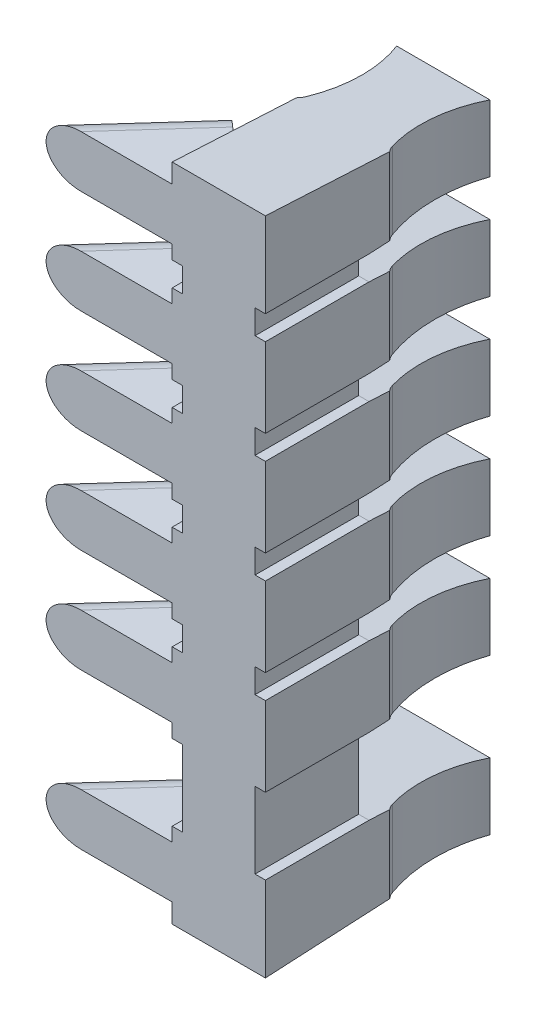
from build123d import *

# Parameters (mm, degrees)
SKETCH1_W           = 15
SKETCH1_H           = 30
BOSS_EXTRUDE1_DEPTH = 7
CUT_EXTRUDE1_START  = -0.3
CUT_EXTRUDE1_DEPTH  = 2.1
CUT_EXTRUDE4_DEPTH  = 2.7
BOSS_EXTRUDE2_DEPTH = 24.556743
CUT_EXTRUDE2_DEPTH  = 27.627139608
CUT_EXTRUDE3_DEPTH  = 27.401285317
SKETCH13_W          = 10
SKETCH13_H          = 20
BOSS_EXTRUDE3_DEPTH = 7
SKETCH14_W          = 3.65
SKETCH14_H          = 19.113486034
CUT_EXTRUDE5_DEPTH  = 13.592908206


with BuildPart() as part:
    # Sketch1 → Boss-Extrude1 (new body)
    with BuildSketch(Plane.XY):
        Rectangle(SKETCH1_W, SKETCH1_H)
    extrude(amount=-BOSS_EXTRUDE1_DEPTH)

    # Sketch8 → Cut-Extrude1 (cut)
    with BuildSketch(Plane(origin=(1.35, 0, 0), x_dir=(0, 0, -1), z_dir=(1, 0, 0)).offset(CUT_EXTRUDE1_START)):
        Polygon((6.5, -4.716092451), (6.5, -2.783907549), (3, -2.600480321), (3, -1.899519679), (6.5, -1.716092451), (6.5, 0.216092451), (3, 0.399519679), (3, 1.100480321), (6.5, 1.283907549), (6.5, 3.216092451), (3, 3.399519679), (3, 4.100480321), (6.5, 4.283907549), (6.5, 6.216092451), (3, 6.399519679), (3, 7.100480321), (6.5, 7.283907549), (6.5, 9.216092451), (0, 9.556743017), (0, -9.556743017), (6.5, -9.216092451), (6.5, -7.283907549), (3, -7.100480321), (3, -4.899519679), align=None)
    extrude(amount=-CUT_EXTRUDE1_DEPTH, mode=Mode.SUBTRACT)

    # Sketch7 → Cut-Extrude4 (cut)
    with BuildSketch(Plane(origin=(1.35, 0, 0), x_dir=(0, 0, -1), z_dir=(1, 0, 0))):
        Polygon((3, 4.100480321), (0, 4.100480321), (0, 6.399519679), (3, 6.399519679), (6.5, 6.216092451), (6.5, 4.283907549), align=None)
        Polygon((3, 1.100480321), (0, 1.100480321), (0, 3.399519679), (3, 3.399519679), (6.5, 3.216092451), (6.5, 1.283907549), align=None)
        Polygon((3, -1.899519679), (0, -1.899519679), (0, 0.399519679), (3, 0.399519679), (6.5, 0.216092451), (6.5, -1.716092451), align=None)
        Polygon((3, -4.899519679), (0, -4.899519679), (0, -2.600480321), (3, -2.600480321), (6.5, -2.783907549), (6.5, -4.716092451), align=None)
        Polygon((3, -7.100480321), (0, -7.100480321), (0, -9.556743017), (6.5, -9.216092451), (6.5, -7.283907549), align=None)
        Polygon((3, 7.100480321), (0, 7.100480321), (0, 9.556743017), (6.5, 9.216092451), (6.5, 7.283907549), align=None)
    extrude(amount=-CUT_EXTRUDE4_DEPTH, mode=Mode.SUBTRACT)

    # Sketch10 → Boss-Extrude2 (add)
    with BuildSketch(Plane(origin=(0, -9.556743017, 0), x_dir=(1, 0, 0), z_dir=(0, 1, 0))):
        with BuildLine():
            Line((1.35, 3.599507213), (1.35, 6.5))
            ThreePointArc((1.35, 6.5), (1.052815056, 5.148153684), (1.246508191, 3.777646361))
            ThreePointArc((1.246508191, 3.777646361), (1.288979573, 3.683188656), (1.35, 3.599507213))
        make_face()
        with BuildLine():
            Line((-1.35, 3.599507213), (-1.35, 6.5))
            ThreePointArc((-1.35, 6.5), (-1.052815056, 5.148153684), (-1.246508191, 3.777646361))
            ThreePointArc((-1.246508191, 3.777646361), (-1.288979573, 3.683188656), (-1.35, 3.599507213))
        make_face()
    extrude(amount=BOSS_EXTRUDE2_DEPTH)

    # Sketch12 → Cut-Extrude2 (cut, through all)
    with BuildSketch(Plane(origin=(3.10411931, 9.156194078, -3.38952842), x_dir=(0, -1, 0), z_dir=(0.669702306213578, 0, 0.7426296661541438))):
        with BuildLine():
            Line((0.156194078, -1.612037756), (0.156194078, -5.06124645))
            Line((0.156194078, -5.06124645), (1.656194078, -5.06124645))
            Line((1.656194078, -5.06124645), (1.656194078, -1.612037756))
            ThreePointArc((1.656194078, -1.612037756), (0.906194078, -0.862037756), (0.156194078, -1.612037756))
        make_face()
        with BuildLine():
            Line((3.156194078, -1.612037756), (3.156194078, -5.06124645))
            Line((3.156194078, -5.06124645), (4.656194078, -5.06124645))
            Line((4.656194078, -5.06124645), (4.656194078, -1.612037756))
            ThreePointArc((4.656194078, -1.612037756), (3.906194078, -0.862037756), (3.156194078, -1.612037756))
        make_face()
        with BuildLine():
            Line((6.156194078, -1.612037756), (6.156194078, -5.06124645))
            Line((6.156194078, -5.06124645), (7.656194078, -5.06124645))
            Line((7.656194078, -5.06124645), (7.656194078, -1.612037756))
            ThreePointArc((7.656194078, -1.612037756), (6.906194078, -0.862037756), (6.156194078, -1.612037756))
        make_face()
        with BuildLine():
            Line((9.156194078, -1.612037756), (9.156194078, -5.06124645))
            Line((9.156194078, -5.06124645), (10.656194078, -5.06124645))
            Line((10.656194078, -5.06124645), (10.656194078, -1.612037756))
            ThreePointArc((10.656194078, -1.612037756), (9.906194078, -0.862037756), (9.156194078, -1.612037756))
        make_face()
        with BuildLine():
            Line((12.156194078, -1.612037756), (12.156194078, -5.06124645))
            Line((12.156194078, -5.06124645), (13.656194078, -5.06124645))
            Line((13.656194078, -5.06124645), (13.656194078, -1.612037756))
            ThreePointArc((13.656194078, -1.612037756), (12.906194078, -0.862037756), (12.156194078, -1.612037756))
        make_face()
        with BuildLine():
            Line((16.656194078, -1.612037756), (16.656194078, -5.06124645))
            Line((16.656194078, -5.06124645), (18.156194078, -5.06124645))
            Line((18.156194078, -5.06124645), (18.156194078, -1.612037756))
            ThreePointArc((18.156194078, -1.612037756), (17.406194078, -0.862037756), (16.656194078, -1.612037756))
        make_face()
    cut_extrude2 = extrude(amount=CUT_EXTRUDE2_DEPTH, mode=Mode.SUBTRACT)

    # Sketch11 → Cut-Extrude3 (cut, through all)
    with BuildSketch(Plane(origin=(2.212963711, 9.156194078, -4.377726578), x_dir=(0, -1, 0), z_dir=(0.6697023062135781, 0, 0.7426296661541438))):
        with BuildLine():
            Line((0.456194078, -2.362037756), (0.456194078, -1.612037756))
            ThreePointArc((0.456194078, -1.612037756), (0.906194078, -1.162037756), (1.356194078, -1.612037756))
            Line((1.356194078, -1.612037756), (1.356194078, -2.362037756))
            Line((1.356194078, -2.362037756), (0.456194078, -2.362037756))
        make_face()
        with BuildLine():
            Line((3.456194078, -1.612037756), (3.456194078, -2.362037756))
            Line((3.456194078, -2.362037756), (4.356194078, -2.362037756))
            Line((4.356194078, -2.362037756), (4.356194078, -1.612037756))
            ThreePointArc((4.356194078, -1.612037756), (3.906194078, -1.162037756), (3.456194078, -1.612037756))
        make_face()
        with BuildLine():
            Line((7.356194078, -1.612037756), (7.356194078, -2.362037756))
            Line((7.356194078, -2.362037756), (6.456194078, -2.362037756))
            Line((6.456194078, -2.362037756), (6.456194078, -1.612037756))
            ThreePointArc((6.456194078, -1.612037756), (6.906194078, -1.162037756), (7.356194078, -1.612037756))
        make_face()
        with BuildLine():
            Line((9.456194078, -1.612037756), (9.456194078, -2.362037756))
            Line((9.456194078, -2.362037756), (10.356194078, -2.362037756))
            Line((10.356194078, -2.362037756), (10.356194078, -1.612037756))
            ThreePointArc((10.356194078, -1.612037756), (9.906194078, -1.162037756), (9.456194078, -1.612037756))
        make_face()
        with BuildLine():
            Line((13.356194078, -1.612037756), (13.356194078, -2.362037756))
            Line((13.356194078, -2.362037756), (12.456194078, -2.362037756))
            Line((12.456194078, -2.362037756), (12.456194078, -1.612037756))
            ThreePointArc((12.456194078, -1.612037756), (12.906194078, -1.162037756), (13.356194078, -1.612037756))
        make_face()
        with BuildLine():
            Line((16.956194078, -1.612037756), (16.956194078, -2.362037756))
            Line((16.956194078, -2.362037756), (17.856194078, -2.362037756))
            Line((17.856194078, -2.362037756), (17.856194078, -1.612037756))
            ThreePointArc((17.856194078, -1.612037756), (17.406194078, -1.162037756), (16.956194078, -1.612037756))
        make_face()
    cut_extrude3 = extrude(amount=CUT_EXTRUDE3_DEPTH, mode=Mode.SUBTRACT)

    # Mirror1: Cut-Extrude2, Cut-Extrude3 across plane
    add(cut_extrude2.mirror(Plane(origin=(0, 0, 0), x_dir=(0, 0, 1), z_dir=(1, 0, 0))), mode=Mode.SUBTRACT)
    add(cut_extrude3.mirror(Plane(origin=(0, 0, 0), x_dir=(0, 0, 1), z_dir=(1, 0, 0))), mode=Mode.SUBTRACT)


with BuildPart() as body_2:
    # Sketch13 → Boss-Extrude3 (new body)
    with BuildSketch(Plane.XY):
        Rectangle(SKETCH13_W, SKETCH13_H)
    extrude(amount=-BOSS_EXTRUDE3_DEPTH)

    # Combine1: cut part
    add(part.part, mode=Mode.SUBTRACT)

    # Sketch14 → Cut-Extrude5 (cut, through all)
    with BuildSketch(Plane.XY):
        with Locations((3.175, 0)):
            Rectangle(SKETCH14_W, SKETCH14_H)
    extrude(amount=-CUT_EXTRUDE5_DEPTH, mode=Mode.SUBTRACT)


solid = body_2.part
